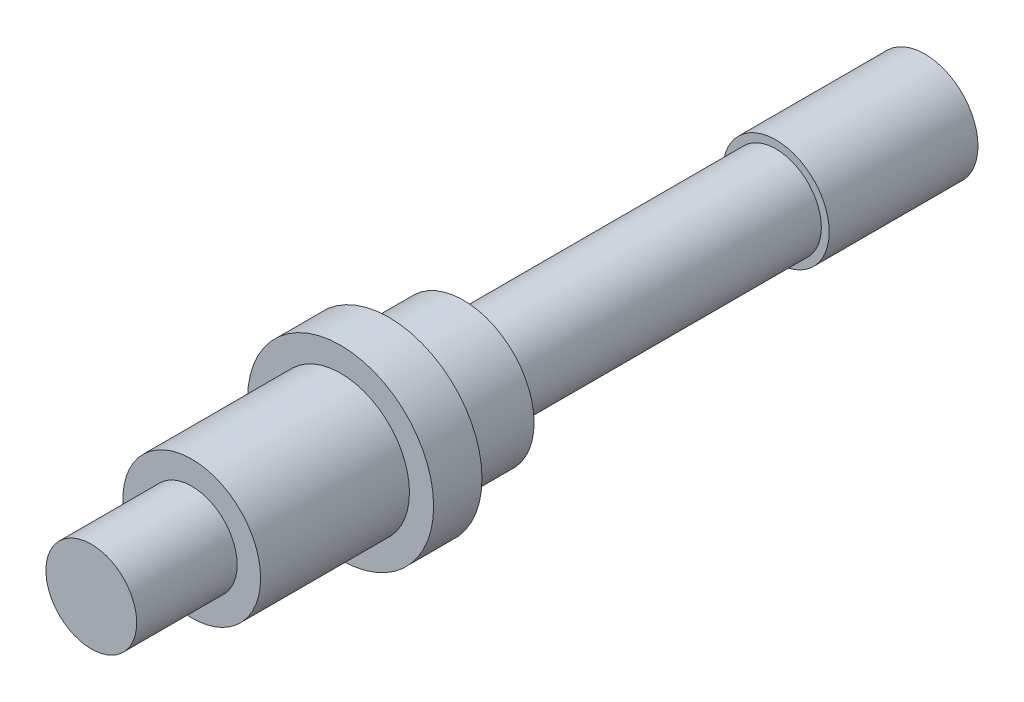
from build123d import *


with BuildPart() as part:
    # Sketch1 → Revolve1 (revolve)
    with BuildSketch(Plane(origin=(0, 0, 0), x_dir=(1, 0, 0), z_dir=(0, 1, 0))):
        Polygon((0, 0), (14.3, 0), (14.3, -40), (12.2, -40), (12.2, -124), (19, -124), (19, -144), (25, -144), (25, -157), (18.5, -157), (18.5, -197), (12.2, -197), (12.2, -224), (0, -224), (0, -139.012446794), align=None)
    revolve(axis=Axis((0, 0, 139.012446794), (0, 0, -1)))


solid = part.part
